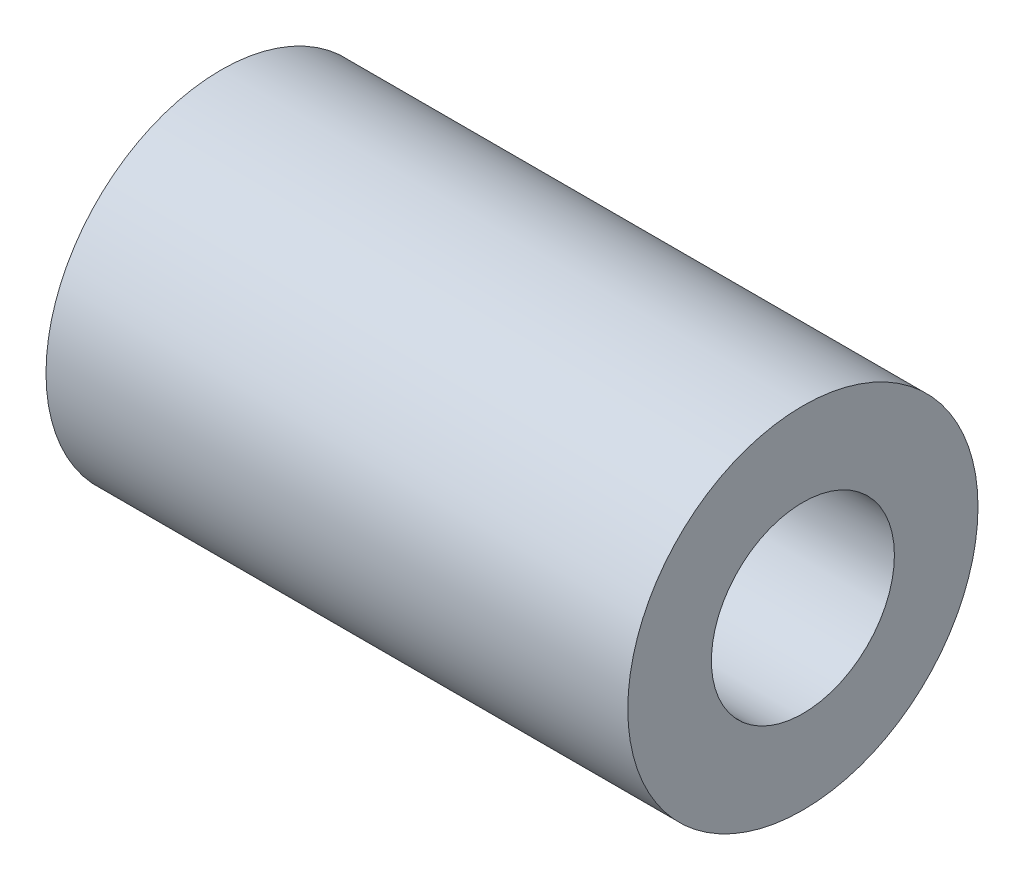
from build123d import *

# Parameters (mm, degrees)
SKETCH1_R           = 4.7625
SKETCH1_R_2         = 2.4892
BOSS_EXTRUDE1_DEPTH = 7.9121


with BuildPart() as part:
    # Sketch1 → Boss-Extrude1 (new, symmetric)
    with BuildSketch(Plane(origin=(0, 0, 0), x_dir=(0, 0, -1), z_dir=(1, 0, 0))):
        Circle(SKETCH1_R)
        Circle(SKETCH1_R_2, mode=Mode.SUBTRACT)
    extrude(amount=BOSS_EXTRUDE1_DEPTH, both=True)


solid = part.part
